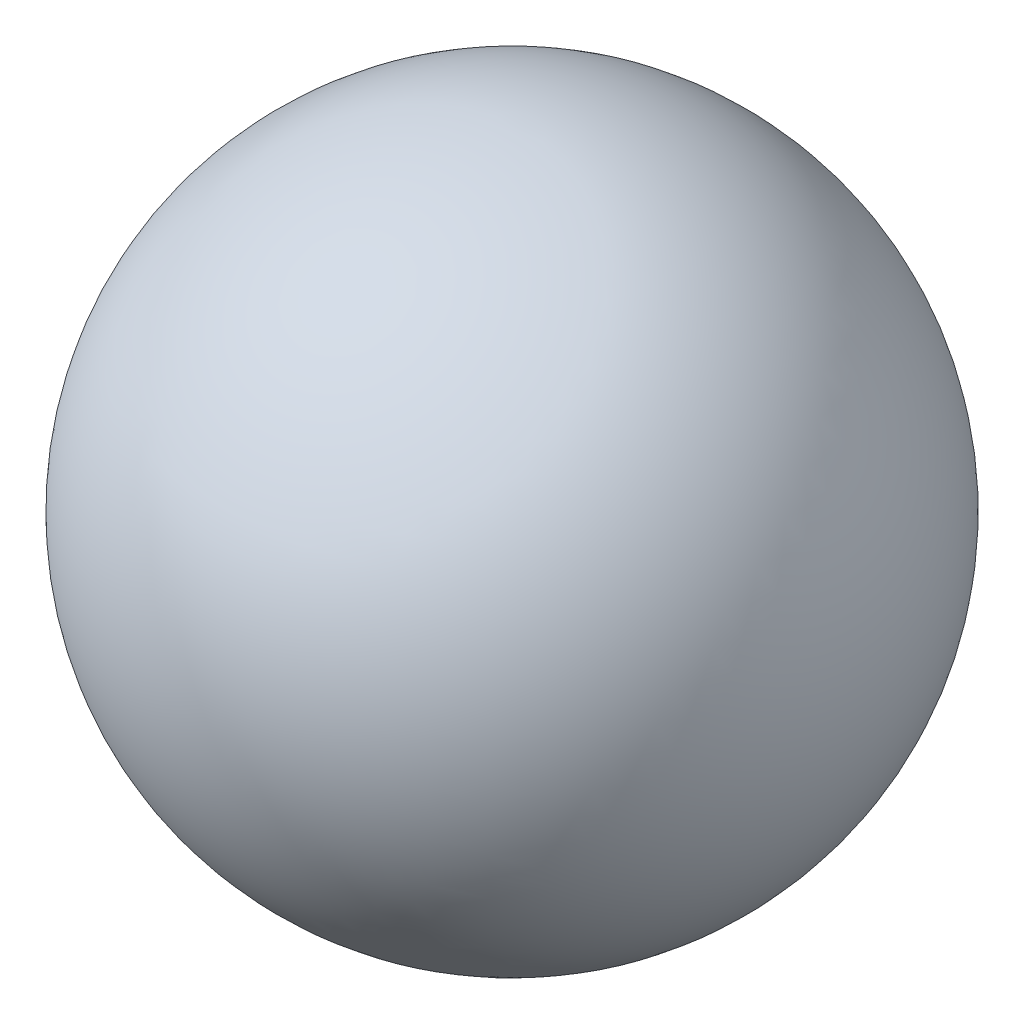
from build123d import *

# Parameters (mm, degrees)
CUT_EXTRUDE1_REACH      = 75.485
CUT_EXTRUDE1_END_RADIUS = 30
SKETCH2_R               = 2.5


with BuildPart() as part:
    # Sketch1 → Revolve1 (revolve)
    with BuildSketch(Plane.XY):
        with BuildLine():
            Line((0, 60), (0, 58))
            ThreePointArc((0, 58), (28, 30), (0, 2))
            Line((0, 2), (0, 0))
            ThreePointArc((0, 0), (30, 30), (0, 60))
        make_face()
    revolve(axis=Axis((0, 0, 0), (0, 1, 0)))

    # Cut-Extrude1: up to this sphere (the profile starts inside it)
    cut_extrude1_end = Location((0, 30, 0)) * Sphere(CUT_EXTRUDE1_END_RADIUS, mode=Mode.PRIVATE)
    # Sketch2 → Cut-Extrude1 (cut, up to the surface)
    with BuildSketch(Plane.XY, mode=Mode.PRIVATE) as cut_extrude1_sk1:
        with Locations(Location((0, 15, 0), (0, 0, 132.607874001))):
            Circle(SKETCH2_R)
    cut_extrude1_tool1 = extrude(cut_extrude1_sk1.sketch, amount=-CUT_EXTRUDE1_REACH, mode=Mode.PRIVATE) & cut_extrude1_end
    add(cut_extrude1_tool1.solids().sort_by_distance((0, 15, 0))[0], mode=Mode.SUBTRACT)


solid = part.part
